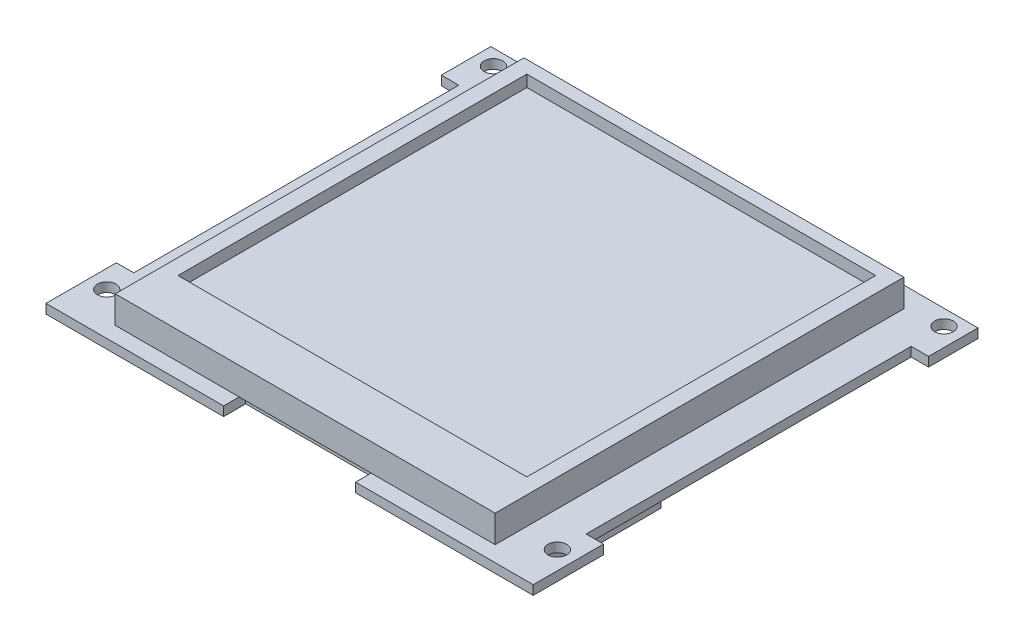
from build123d import *

# Parameters (mm, degrees)
SKETCH_1_R          = 1.6
EXTRUDE_1_DEPTH     = 1.6
EXTRUDE_START       = 1.6
SKETCH_1_3_W        = 65.35
SKETCH_1_3_H        = 70.3
EXTRUDE_2_DEPTH     = 4.7
CUT_EXTRUDE_START   = 6.3
SKETCH_1_4_W        = 60
SKETCH_1_4_H        = 60
CUT_EXTRUDE_1_DEPTH = 2
SKETCH_2_W          = 5
SKETCH_2_H          = 23.26
EXTRUDE_3_DEPTH     = 9
SKETCH_2_3_W        = 1.15
SKETCH_2_3_H        = 0.6
EXTRUDE_4_DEPTH     = 0.5
CUT_EXTRUDE_START_2 = 9
SKETCH_2_4_W        = 1.5
SKETCH_2_4_H        = 1.5
CUT_EXTRUDE_2_DEPTH = 5


with BuildPart() as part:
    # 草图1 → 凸台-拉伸1 (new body)
    with BuildSketch(Plane(origin=(0, 0, 0), x_dir=(1, 0, 0), z_dir=(0, 1, 0))):
        Polygon((-41.9, 76.5), (-41.9, 68), (-38.9, 68), (-38.9, 12.1), (-41.9, 12.1), (-41.9, 0), (-11.35, 0), (-11.35, 3.8), (11.35, 3.8), (11.35, 0), (41.9, 0), (41.9, 12.1), (38.9, 12.1), (38.9, 68), (41.9, 68), (41.9, 76.5), align=None)
        with Locations(Location((-38.75, 73.8, 0), (0, 0, 270))):
            Circle(SKETCH_1_R, mode=Mode.SUBTRACT)
        with Locations(Location((38.75, 73.8, 0), (0, 0, 270))):
            Circle(SKETCH_1_R, mode=Mode.SUBTRACT)
        with Locations(Location((38.75, 7.3, 0), (0, 0, 270))):
            Circle(SKETCH_1_R, mode=Mode.SUBTRACT)
        with Locations(Location((-38.75, 7.3, 0), (0, 0, 270))):
            Circle(SKETCH_1_R, mode=Mode.SUBTRACT)
    extrude(amount=EXTRUDE_1_DEPTH)


with BuildPart() as body_2:
    # 草图1<3> → 凸台-拉伸2 (new body)
    with BuildSketch(Plane(origin=(0, 0, 0), x_dir=(1, 0, 0), z_dir=(0, 1, 0)).offset(EXTRUDE_START)):
        with Locations((0, 37.83)):
            Rectangle(SKETCH_1_3_W, SKETCH_1_3_H)
    extrude(amount=EXTRUDE_2_DEPTH)

    # 草图1<4> → 切除-拉伸1 (cut)
    with BuildSketch(Plane(origin=(0, 0, 0), x_dir=(1, 0, 0), z_dir=(0, 1, 0)).offset(CUT_EXTRUDE_START)):
        with Locations((0, 40.8)):
            Rectangle(SKETCH_1_4_W, SKETCH_1_4_H)
    extrude(amount=-CUT_EXTRUDE_1_DEPTH, mode=Mode.SUBTRACT)


with BuildPart() as body_3:
    # 草图2 → 凸台-拉伸3 (new body)
    with BuildSketch(Plane.XZ):
        with Locations((28.4, -21.36)):
            Rectangle(SKETCH_2_W, SKETCH_2_H)
    extrude(amount=EXTRUDE_3_DEPTH)

    # 草图2<3> → 凸台-拉伸4 (add)
    with BuildSketch(Plane.XZ):
        with Locations((31.475, -13.74)):
            Rectangle(SKETCH_2_3_W, SKETCH_2_3_H)
        with Locations((31.475, -11.2)):
            Rectangle(SKETCH_2_3_W, SKETCH_2_3_H)
        with Locations((31.475, -16.28)):
            Rectangle(SKETCH_2_3_W, SKETCH_2_3_H)
        with Locations((31.475, -18.82)):
            Rectangle(SKETCH_2_3_W, SKETCH_2_3_H)
        with Locations((31.475, -21.36)):
            Rectangle(SKETCH_2_3_W, SKETCH_2_3_H)
        with Locations((31.475, -23.9)):
            Rectangle(SKETCH_2_3_W, SKETCH_2_3_H)
        with Locations((31.475, -26.44)):
            Rectangle(SKETCH_2_3_W, SKETCH_2_3_H)
        with Locations((31.475, -28.98)):
            Rectangle(SKETCH_2_3_W, SKETCH_2_3_H)
        with Locations((31.475, -31.52)):
            Rectangle(SKETCH_2_3_W, SKETCH_2_3_H)
        with Locations((25.325, -31.52)):
            Rectangle(SKETCH_2_3_W, SKETCH_2_3_H)
        with Locations((25.325, -28.98)):
            Rectangle(SKETCH_2_3_W, SKETCH_2_3_H)
        with Locations((25.325, -26.44)):
            Rectangle(SKETCH_2_3_W, SKETCH_2_3_H)
        with Locations((25.325, -23.9)):
            Rectangle(SKETCH_2_3_W, SKETCH_2_3_H)
        with Locations((25.325, -21.36)):
            Rectangle(SKETCH_2_3_W, SKETCH_2_3_H)
        with Locations((25.325, -18.82)):
            Rectangle(SKETCH_2_3_W, SKETCH_2_3_H)
        with Locations((25.325, -16.28)):
            Rectangle(SKETCH_2_3_W, SKETCH_2_3_H)
        with Locations((25.325, -13.74)):
            Rectangle(SKETCH_2_3_W, SKETCH_2_3_H)
        with Locations((25.325, -11.2)):
            Rectangle(SKETCH_2_3_W, SKETCH_2_3_H)
    extrude(amount=EXTRUDE_4_DEPTH)

    # 草图2<4> → 切除-拉伸2 (cut)
    with BuildSketch(Plane.XZ.offset(CUT_EXTRUDE_START_2)):
        with Locations((29.67, -11.2)):
            Rectangle(SKETCH_2_4_W, SKETCH_2_4_H)
        with Locations((27.13, -11.2)):
            Rectangle(SKETCH_2_4_W, SKETCH_2_4_H)
        with Locations((27.13, -13.74)):
            Rectangle(SKETCH_2_4_W, SKETCH_2_4_H)
        with Locations((29.67, -13.74)):
            Rectangle(SKETCH_2_4_W, SKETCH_2_4_H)
        with Locations((27.13, -16.28)):
            Rectangle(SKETCH_2_4_W, SKETCH_2_4_H)
        with Locations((29.67, -16.28)):
            Rectangle(SKETCH_2_4_W, SKETCH_2_4_H)
        with Locations((27.13, -18.82)):
            Rectangle(SKETCH_2_4_W, SKETCH_2_4_H)
        with Locations((29.67, -18.82)):
            Rectangle(SKETCH_2_4_W, SKETCH_2_4_H)
        with Locations((27.13, -21.36)):
            Rectangle(SKETCH_2_4_W, SKETCH_2_4_H)
        with Locations((29.67, -21.36)):
            Rectangle(SKETCH_2_4_W, SKETCH_2_4_H)
        with Locations((27.13, -23.9)):
            Rectangle(SKETCH_2_4_W, SKETCH_2_4_H)
        with Locations((29.67, -23.9)):
            Rectangle(SKETCH_2_4_W, SKETCH_2_4_H)
        with Locations((27.13, -26.44)):
            Rectangle(SKETCH_2_4_W, SKETCH_2_4_H)
        with Locations((29.67, -26.44)):
            Rectangle(SKETCH_2_4_W, SKETCH_2_4_H)
        with Locations((27.13, -28.98)):
            Rectangle(SKETCH_2_4_W, SKETCH_2_4_H)
        with Locations((29.67, -28.98)):
            Rectangle(SKETCH_2_4_W, SKETCH_2_4_H)
        with Locations((27.13, -31.52)):
            Rectangle(SKETCH_2_4_W, SKETCH_2_4_H)
        with Locations((29.67, -31.52)):
            Rectangle(SKETCH_2_4_W, SKETCH_2_4_H)
    extrude(amount=-CUT_EXTRUDE_2_DEPTH, mode=Mode.SUBTRACT)


solid = Compound([part.part, body_2.part, body_3.part])
